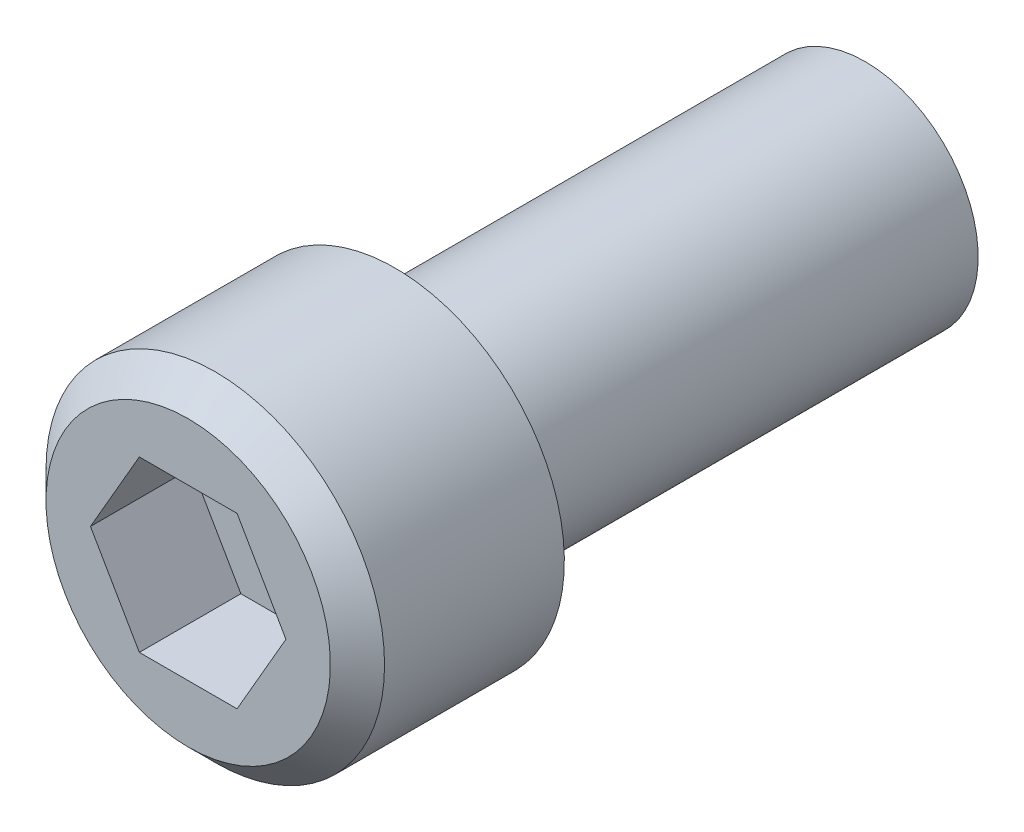
from build123d import *

# Parameters (mm, degrees)
CHAMFER_1_SIZE      = 0.72
CUT_EXTRUDE_1_DEPTH = 2.7


with BuildPart() as part:
    # 草图2 → 旋转1 (revolve)
    with BuildSketch(Plane(origin=(0, 0, 0), x_dir=(0, 0, -1), z_dir=(1, 0, 0)), mode=Mode.PRIVATE) as revolve_1_sk:
        Polygon((0, 0), (0, 4.5), (5.5, 4.5), (5.5, 3), (18, 3), (18, 0), align=None)
    revolve(revolve_1_sk.sketch.rotate(Axis((0, 0, 0), (0, 0, -1)), 180), axis=Axis((0, 0, 0), (0, 0, -1)))

    # 倒角1
    chamfer_1_edges = [part.edges().sort_by_distance(p)[0] for p in [
        (0, 4.5, 0),
    ]]
    chamfer(chamfer_1_edges, length=CHAMFER_1_SIZE)

    # 草图3 → 切除-拉伸1 (cut)
    with BuildSketch(Plane.XY):
        Polygon((2.598076211, 0), (1.299038106, 2.25), (-1.299038106, 2.25), (-2.598076211, 0), (-1.299038106, -2.25), (1.299038106, -2.25), align=None)
    extrude(amount=-CUT_EXTRUDE_1_DEPTH, mode=Mode.SUBTRACT)


solid = part.part
